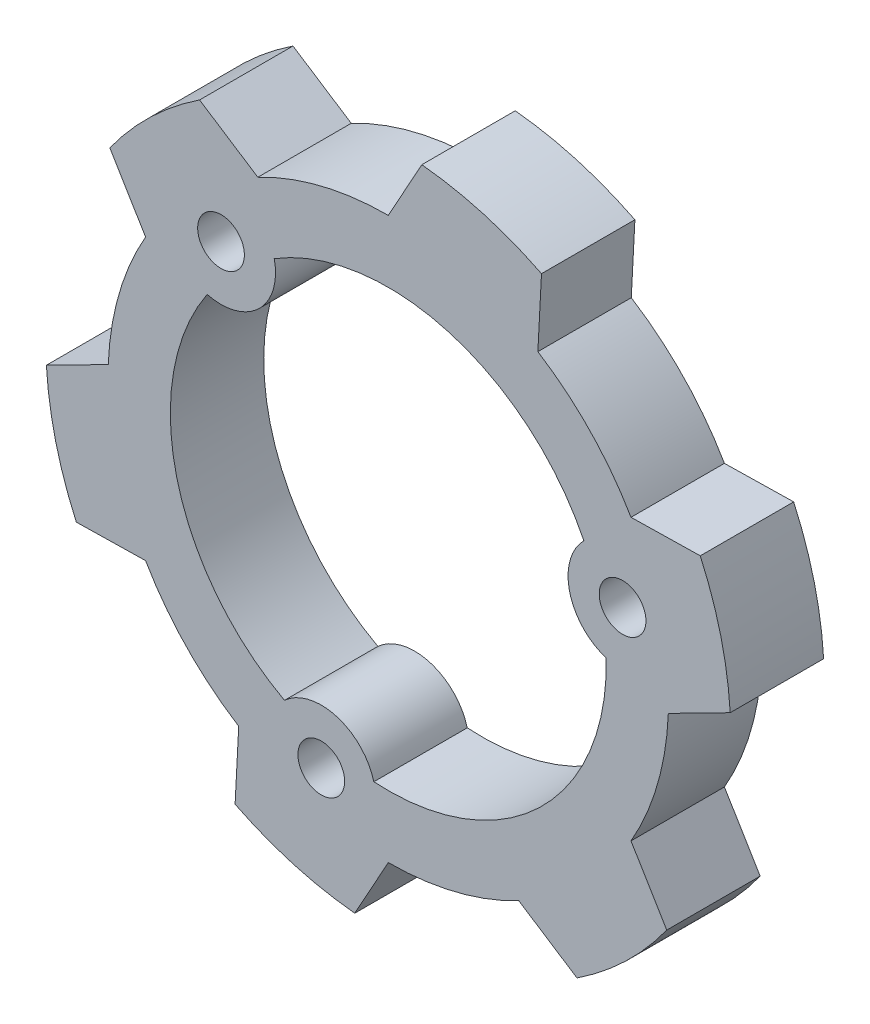
from build123d import *

# Parameters (mm, degrees)
ESQUISSE1_R        = 1.5
BOSS_EXTRU_1_DEPTH = 6


with BuildPart() as part:
    # Esquisse1 → Boss.-Extru.1 (new body)
    with BuildSketch(Plane.XY):
        with BuildLine():
            Line((0, 18), (2.153216979, 21.894375))
            ThreePointArc((2.153216979, 21.894375), (6.098122971, 21.137949197), (9.83974396, 19.676875738))
            Line((9.83974396, 19.676875738), (9.606453592, 15.222222222))
            ThreePointArc((9.606453592, 15.222222222), (12.975935252, 12.474979132), (15.588457268, 9))
            Line((15.588457268, 9), (20.03769344, 9.082446896))
            ThreePointArc((20.03769344, 9.082446896), (21.355062473, 5.28784519), (21.960546236, 1.316969633))
            Line((21.960546236, 1.316969633), (17.986057943, -0.70832174))
            ThreePointArc((17.986057943, -0.70832174), (17.291616466, -5), (15.588457268, -9))
            Line((15.588457268, -9), (17.88447646, -12.811928104))
            ThreePointArc((17.88447646, -12.811928104), (15.256939503, -15.850104006), (12.120802276, -18.359906105))
            Line((12.120802276, -18.359906105), (8.37960435, -15.930543962))
            ThreePointArc((8.37960435, -15.930543962), (4.315681214, -17.474979132), (0, -18))
            Line((0, -18), (-2.153216979, -21.894375))
            ThreePointArc((-2.153216979, -21.894375), (-6.098122971, -21.137949197), (-9.83974396, -19.676875738))
            Line((-9.83974396, -19.676875738), (-9.606453592, -15.222222222))
            ThreePointArc((-9.606453592, -15.222222222), (-12.975935252, -12.474979132), (-15.588457268, -9))
            Line((-15.588457268, -9), (-20.03769344, -9.082446896))
            ThreePointArc((-20.03769344, -9.082446896), (-21.355062473, -5.28784519), (-21.960546236, -1.316969633))
            Line((-21.960546236, -1.316969633), (-17.986057943, 0.70832174))
            ThreePointArc((-17.986057943, 0.70832174), (-17.291616466, 5), (-15.588457268, 9))
            Line((-15.588457268, 9), (-17.88447646, 12.811928104))
            ThreePointArc((-17.88447646, 12.811928104), (-15.256939503, 15.850104006), (-12.120802276, 18.359906105))
            Line((-12.120802276, 18.359906105), (-8.37960435, 15.930543962))
            ThreePointArc((-8.37960435, 15.930543962), (-4.315681214, 17.474979132), (0, 18))
        make_face()
        with Locations((-10.743337321, 11.17276614)):
            Circle(ESQUISSE1_R, mode=Mode.SUBTRACT)
        with Locations((15.047567968, 3.717619972)):
            Circle(ESQUISSE1_R, mode=Mode.SUBTRACT)
        with Locations((-4.304230647, -14.890386111)):
            Circle(ESQUISSE1_R, mode=Mode.SUBTRACT)
        with BuildLine():
            ThreePointArc((-11.633900603, 7.787962299), (-13.591351713, -3.357850297), (-6.668605179, -12.309740248))
            ThreePointArc((-6.668605179, -12.309740248), (-3.332307598, -11.52804086), (-0.927622893, -13.969234616))
            ThreePointArc((-0.927622893, -13.969234616), (9.703659516, -10.091530707), (13.994850358, 0.379688631))
            ThreePointArc((13.994850358, 0.379688631), (11.64973004, 2.878157397), (12.561523496, 6.181272318))
            ThreePointArc((12.561523496, 6.181272318), (3.887692197, 13.449381004), (-7.326245179, 11.930051617))
            ThreePointArc((-7.326245179, 11.930051617), (-8.317422442, 8.649883463), (-11.633900603, 7.787962299))
        make_face(mode=Mode.SUBTRACT)
    extrude(amount=BOSS_EXTRU_1_DEPTH)


solid = part.part
